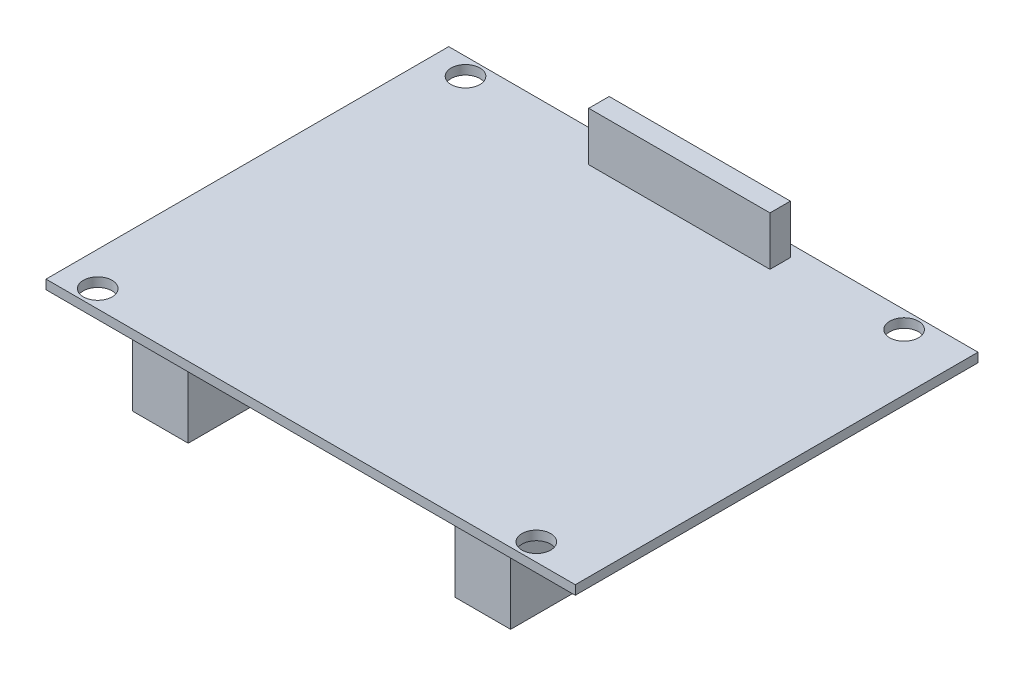
from build123d import *

# Parameters (mm, degrees)
SKETCH1_W                = 92
SKETCH1_H                = 70
SKETCH1_R                = 2.5
Y_PCB_EXTR_DEPTH         = 1.6
SKETCH2_W                = 31.5
SKETCH2_H                = 3.55
Y_HEADER_EXTR_DEPTH      = 8.5
SKETCH3_W                = 9.71
SKETCH3_H                = 62.95
SKETCH3_H_2              = 63.06
Y_MOLEX_POWER_EXTR_DEPTH = 12.88


with BuildPart() as part:
    # Sketch1 → Y+ PCB extr (new body)
    with BuildSketch(Plane(origin=(0, 0, 0), x_dir=(1, 0, 0), z_dir=(0, 1, 0))):
        with Locations((46, 35)):
            Rectangle(SKETCH1_W, SKETCH1_H)
        with Locations(Location((5.92, 3.07, 0), (0, 0, 270))):
            Circle(SKETCH1_R, mode=Mode.SUBTRACT)
        with Locations(Location((82.16, 3.07, 0), (0, 0, 270))):
            Circle(SKETCH1_R, mode=Mode.SUBTRACT)
        with Locations(Location((82.16, 67, 0), (0, 0, 270))):
            Circle(SKETCH1_R, mode=Mode.SUBTRACT)
        with Locations(Location((5.92, 67, 0), (0, 0, 270))):
            Circle(SKETCH1_R, mode=Mode.SUBTRACT)
    extrude(amount=Y_PCB_EXTR_DEPTH)

    # Sketch2 → Y+ header extr (add)
    with BuildSketch(Plane(origin=(0, 1.6, 0), x_dir=(1, 0, 0), z_dir=(0, 1, 0))):
        with Locations((45.7, 66.165)):
            Rectangle(SKETCH2_W, SKETCH2_H)
    extrude(amount=Y_HEADER_EXTR_DEPTH)

    # Sketch3 → Y- MOLEX power extr (add)
    with BuildSketch(Plane.XZ):
        with Locations((73.775, -33.605)):
            Rectangle(SKETCH3_W, SKETCH3_H)
        with Locations((17.735, -33.66)):
            Rectangle(SKETCH3_W, SKETCH3_H_2)
    extrude(amount=Y_MOLEX_POWER_EXTR_DEPTH)


solid = part.part
